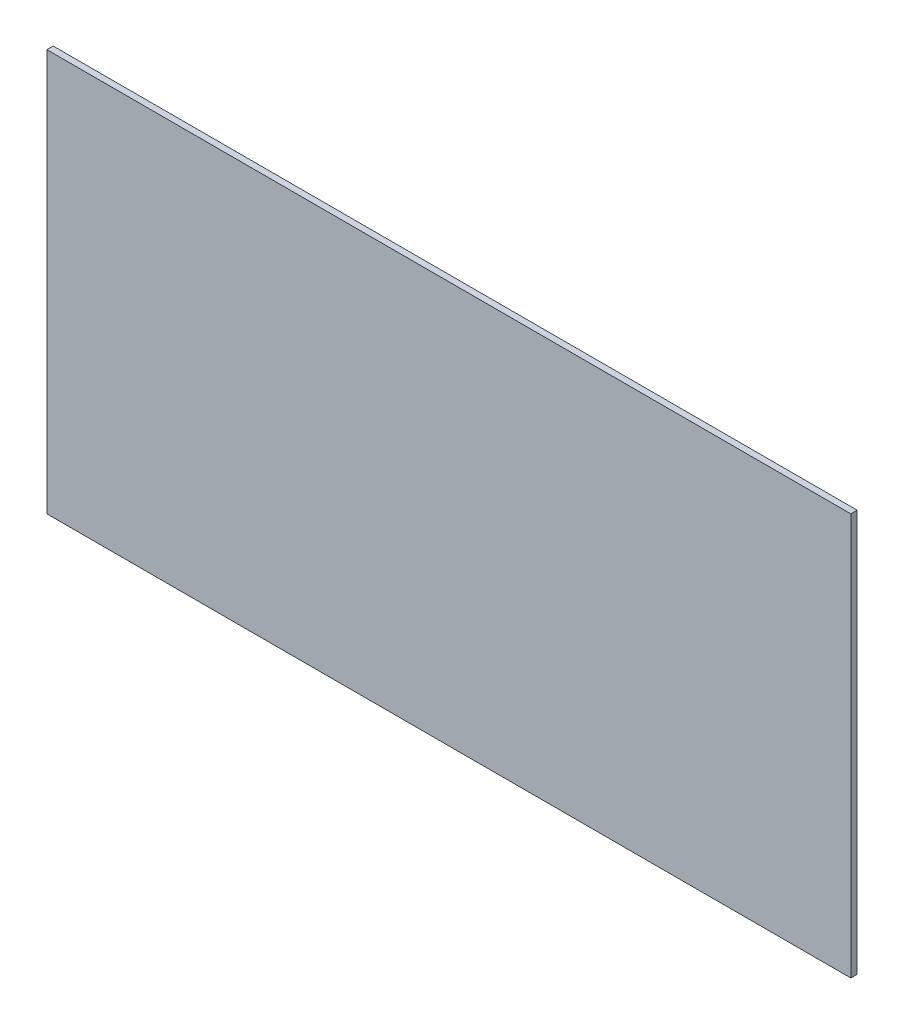
from build123d import *

# Parameters (mm, degrees)
SKETCH1_W               = 1.27
SKETCH1_H               = 0.635
COMPONENT_OUTLINE_DEPTH = 0.01


with BuildPart() as part:
    # Sketch1 → Component_Outline (new body)
    with BuildSketch(Plane.XY):
        Rectangle(SKETCH1_W, SKETCH1_H)
    extrude(amount=COMPONENT_OUTLINE_DEPTH)


solid = part.part
